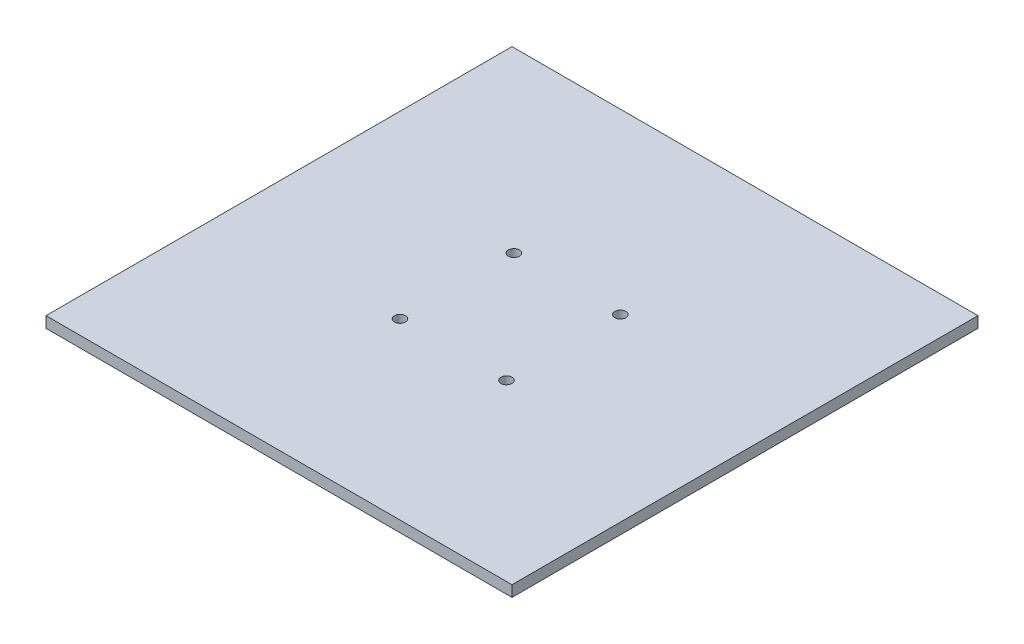
from build123d import *

# Parameters (mm, degrees)
SKETCH2_W           = 126.877068242
SKETCH2_H           = 126.877068242
SKETCH2_R           = 1.5
BOSS_EXTRUDE1_DEPTH = 3


with BuildPart() as part:
    # Sketch2 → Boss-Extrude1 (new body)
    with BuildSketch(Plane(origin=(0, 0, 0), x_dir=(1, 0, 0), z_dir=(0, 1, 0))):
        Rectangle(SKETCH2_W, SKETCH2_H)
        with Locations(Location((14.5, 15, 0), (0, 0, 270))):
            Circle(SKETCH2_R, mode=Mode.SUBTRACT)
        with Locations(Location((-14.5, 15, 0), (0, 0, 270))):
            Circle(SKETCH2_R, mode=Mode.SUBTRACT)
        with Locations(Location((-14.5, -16, 0), (0, 0, 270))):
            Circle(SKETCH2_R, mode=Mode.SUBTRACT)
        with Locations(Location((14.5, -16, 0), (0, 0, 270))):
            Circle(SKETCH2_R, mode=Mode.SUBTRACT)
    extrude(amount=BOSS_EXTRUDE1_DEPTH)


solid = part.part
